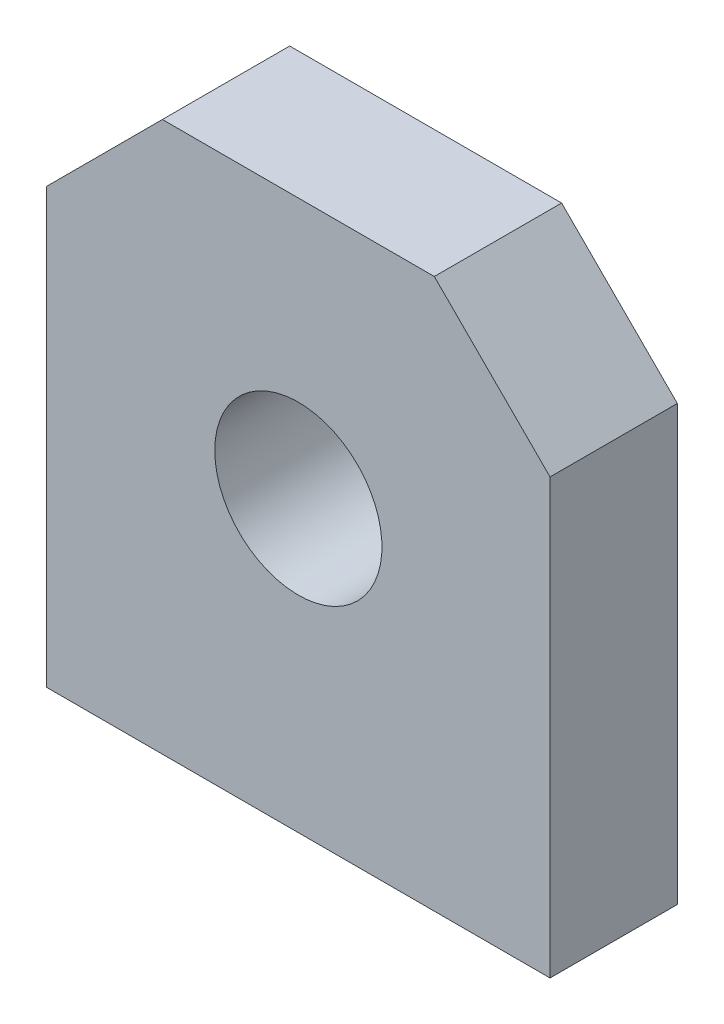
from build123d import *

# Parameters (mm, degrees)
BOSS_EXTRUDE1_DEPTH = 2.794
SKETCH2_R           = 1.834902778
CUT_EXTRUDE1_DEPTH  = 2.794


with BuildPart() as part:
    # Sketch1 → Boss-Extrude1 (new body)
    with BuildSketch(Plane.XY):
        Polygon((-5.5245, 3.4925), (-2.9845, 6.0325), (2.9845, 6.0325), (5.5245, 3.4925), (5.5245, -6.0325), (-5.5245, -6.0325), align=None)
    extrude(amount=BOSS_EXTRUDE1_DEPTH)

    # Sketch2 → Cut-Extrude1 (cut)
    with BuildSketch(Plane(origin=(0, 0, 0), x_dir=(-1, 0, 0), z_dir=(0, 0, -1))):
        with Locations((0, 0.3175)):
            Circle(SKETCH2_R)
    extrude(amount=-CUT_EXTRUDE1_DEPTH, mode=Mode.SUBTRACT)


solid = part.part
